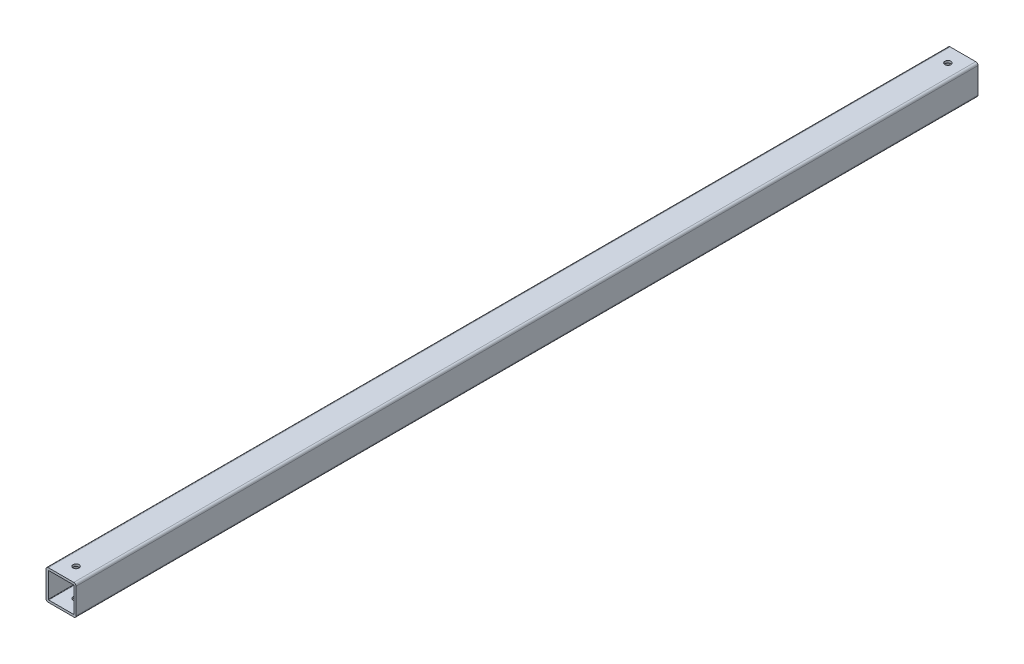
from build123d import *

# Parameters (mm, degrees)
SKETCH1_W                = 40
SKETCH1_H                = 40
SKETCH1_W_2              = 34
SKETCH1_H_2              = 34
EXTRUDE_THIN1_DEPTH      = 1200
FILLET1_R                = 0.5
FILLET2_R                = 3
F_8_0_8_DIAMETER_HOLE1_D = 8


with BuildPart() as part:
    # Sketch1 → Extrude-Thin1 (new body)
    with BuildSketch(Plane.XY):
        Rectangle(SKETCH1_W, SKETCH1_H)
        Rectangle(SKETCH1_W_2, SKETCH1_H_2, mode=Mode.SUBTRACT)
    extrude(amount=EXTRUDE_THIN1_DEPTH)

    # Fillet1
    fillet1_edges = [part.edges().sort_by_distance(p)[0] for p in [
        (17, -17, 600),
        (17, 17, 600),
        (-17, 17, 600),
        (-17, -17, 600),
    ]]
    fillet(fillet1_edges, radius=FILLET1_R)

    # Fillet2
    fillet2_edges = [part.edges().sort_by_distance(p)[0] for p in [
        (20, -20, 600),
        (-20, -20, 600),
        (-20, 20, 600),
        (20, 20, 600),
    ]]
    fillet(fillet2_edges, radius=FILLET2_R)

    # Ø8.0 (8) Diameter Hole1 (through all)
    with Locations(Plane(origin=(0, 20, 0), x_dir=(1, 0, 0), z_dir=(0, 1, 0))):
        with Locations((0, -1180), (0, -20)):
            Hole(F_8_0_8_DIAMETER_HOLE1_D / 2)


solid = part.part
